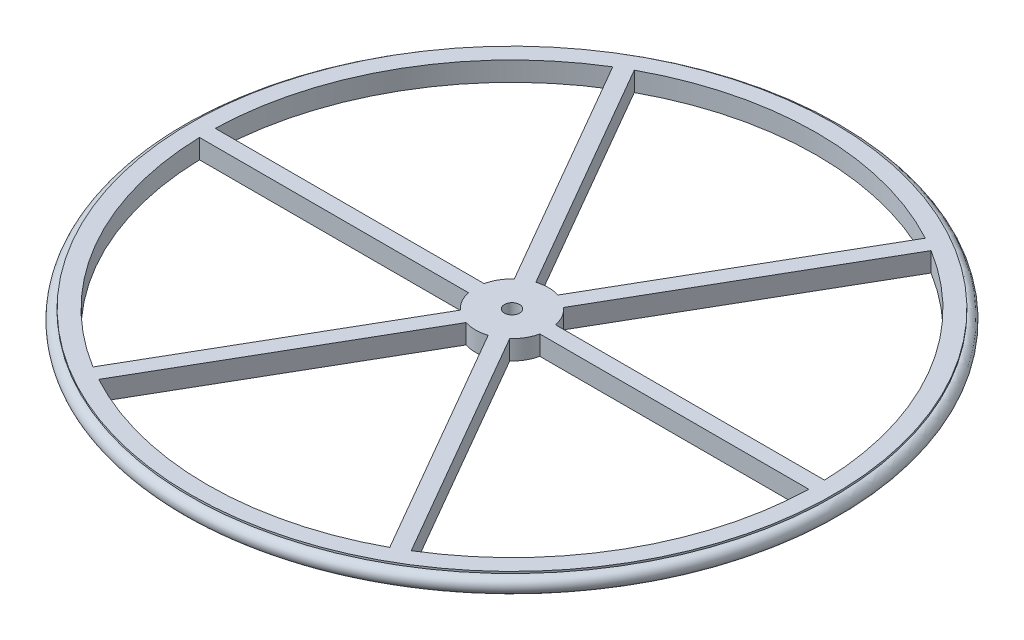
from build123d import *

# Parameters (mm, degrees)
SKETCH1_R           = 175.7
SKETCH1_R_2         = 4.125
BOSS_EXTRUDE1_DEPTH = 10.6
SKETCH3_R           = 4.3
SKETCH5_R           = 4.3


with BuildPart() as part:
    # Sketch1 → Boss-Extrude1 (new body)
    with BuildSketch(Plane(origin=(0, 0, 0), x_dir=(1, 0, 0), z_dir=(0, 1, 0))):
        with Locations(Location((0, 0, 0), (0, 0, 270))):
            Circle(SKETCH1_R)
        with Locations(Location((0, 0, 0), (0, 0, 270))):
            Circle(SKETCH1_R_2, mode=Mode.SUBTRACT)
        with BuildLine():
            Line((-19.532280973, 4.3), (-166.4, 4.3))
            ThreePointArc((-166.4, 4.3), (-144.154734574, 83.227774811), (-86.923909236, 141.95662719))
            Line((-86.923909236, 141.95662719), (-13.490049723, 14.765451516))
            ThreePointArc((-13.490049723, 14.765451516), (-17.320508076, 10), (-19.532280973, 4.3))
        make_face(mode=Mode.SUBTRACT)
        with BuildLine():
            Line((-19.532280973, -4.3), (-166.4, -4.3))
            ThreePointArc((-166.4, -4.3), (-144.154734574, -83.227774811), (-86.923909236, -141.95662719))
            Line((-86.923909236, -141.95662719), (-13.490049723, -14.765451516))
            ThreePointArc((-13.490049723, -14.765451516), (-17.320508076, -10), (-19.532280973, -4.3))
        make_face(mode=Mode.SUBTRACT)
        with BuildLine():
            Line((-6.04223125, 19.065451516), (-79.476090764, 146.25662719))
            ThreePointArc((-79.476090764, 146.25662719), (0, 166.455549622), (79.476090764, 146.25662719))
            Line((79.476090764, 146.25662719), (6.04223125, 19.065451516))
            ThreePointArc((6.04223125, 19.065451516), (0, 20), (-6.04223125, 19.065451516))
        make_face(mode=Mode.SUBTRACT)
        with BuildLine():
            Line((13.490049723, 14.765451516), (86.923909236, 141.95662719))
            ThreePointArc((86.923909236, 141.95662719), (144.154734574, 83.227774811), (166.4, 4.3))
            Line((166.4, 4.3), (19.532280973, 4.3))
            ThreePointArc((19.532280973, 4.3), (17.320508076, 10), (13.490049723, 14.765451516))
        make_face(mode=Mode.SUBTRACT)
        with BuildLine():
            Line((19.532280973, -4.3), (166.4, -4.3))
            ThreePointArc((166.4, -4.3), (144.154734574, -83.227774811), (86.923909236, -141.95662719))
            Line((86.923909236, -141.95662719), (13.490049723, -14.765451516))
            ThreePointArc((13.490049723, -14.765451516), (17.320508076, -10), (19.532280973, -4.3))
        make_face(mode=Mode.SUBTRACT)
        with BuildLine():
            Line((6.04223125, -19.065451516), (79.476090764, -146.25662719))
            ThreePointArc((79.476090764, -146.25662719), (0, -166.455549622), (-79.476090764, -146.25662719))
            Line((-79.476090764, -146.25662719), (-6.04223125, -19.065451516))
            ThreePointArc((-6.04223125, -19.065451516), (0, -20), (6.04223125, -19.065451516))
        make_face(mode=Mode.SUBTRACT)
    extrude(amount=BOSS_EXTRUDE1_DEPTH)

    # Sketch3 → Cut-Revolve1 (revolve, cut)
    with BuildSketch(Plane.XY, mode=Mode.PRIVATE) as cut_revolve1_sk:
        with Locations((175.7, 5.3)):
            Circle(SKETCH3_R)
    revolve(cut_revolve1_sk.sketch.rotate(Axis((0, 0, 0), (0, 1, 0)), 90), axis=Axis((0, 0, 0), (0, 1, 0)), mode=Mode.SUBTRACT)

    # Sketch5 → Revolve1 (revolve)
    with BuildSketch(Plane(origin=(0, 0, 0), x_dir=(0, 0, -1), z_dir=(1, 0, 0))):
        with Locations((175.7, 5.3)):
            Circle(SKETCH5_R)
    revolve(axis=Axis((0, 0, 0), (0, 1, 0)))


solid = part.part
